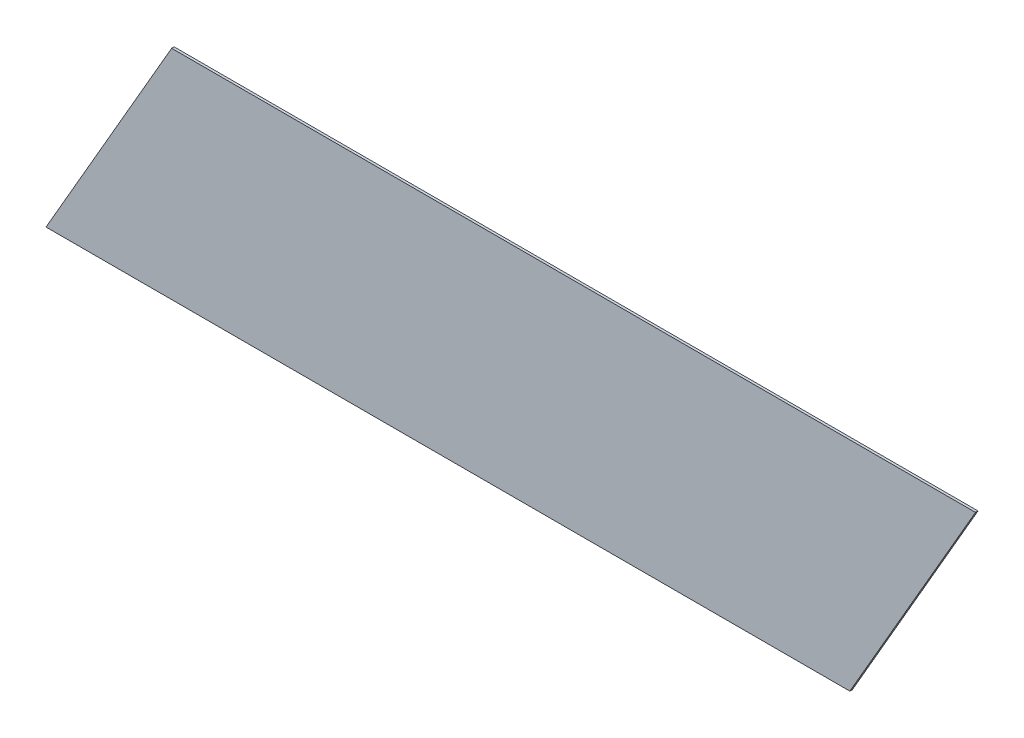
from build123d import *

# Parameters (mm, degrees)
BOSS_EXTRUDE1_DEPTH = 0.2


with BuildPart() as part:
    # Sketch1 → Boss-Extrude1 (new body)
    with BuildSketch(Plane.XY):
        Polygon((0, 0), (10.161364738, 17.6), (75.161364738, 17.6), (65, 0), align=None)
    extrude(amount=BOSS_EXTRUDE1_DEPTH)


solid = part.part
